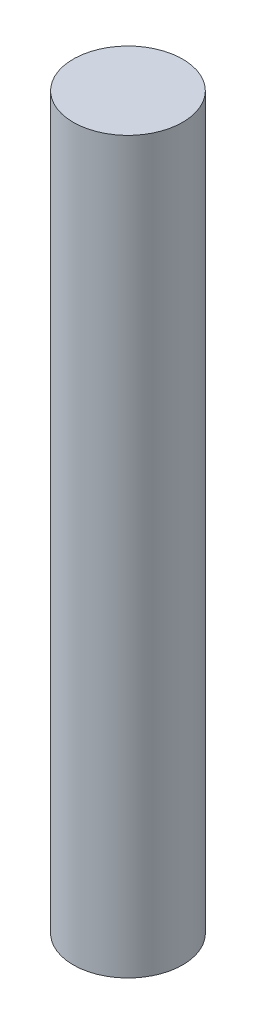
from build123d import *

# Parameters (mm, degrees)
SKETCH_1_R          = 7.5
EXTRUDE_1_DEPTH     = 100
SKETCH_2_R          = 2
CUT_EXTRUDE_1_DEPTH = 10


with BuildPart() as part:
    # 스케치1 → 보스-돌출1 (new body)
    with BuildSketch(Plane(origin=(0, 0, 0), x_dir=(1, 0, 0), z_dir=(0, 1, 0))):
        with Locations(Location((0, 0, 0), (0, 0, 270))):
            Circle(SKETCH_1_R)
    extrude(amount=EXTRUDE_1_DEPTH)

    # 스케치2 → 컷-돌출1 (cut)
    with BuildSketch(Plane.XY):
        with Locations((0, 40)):
            Circle(SKETCH_2_R)
        with Locations((0, 60)):
            Circle(SKETCH_2_R)
    extrude(amount=-CUT_EXTRUDE_1_DEPTH, mode=Mode.SUBTRACT)


solid = part.part
